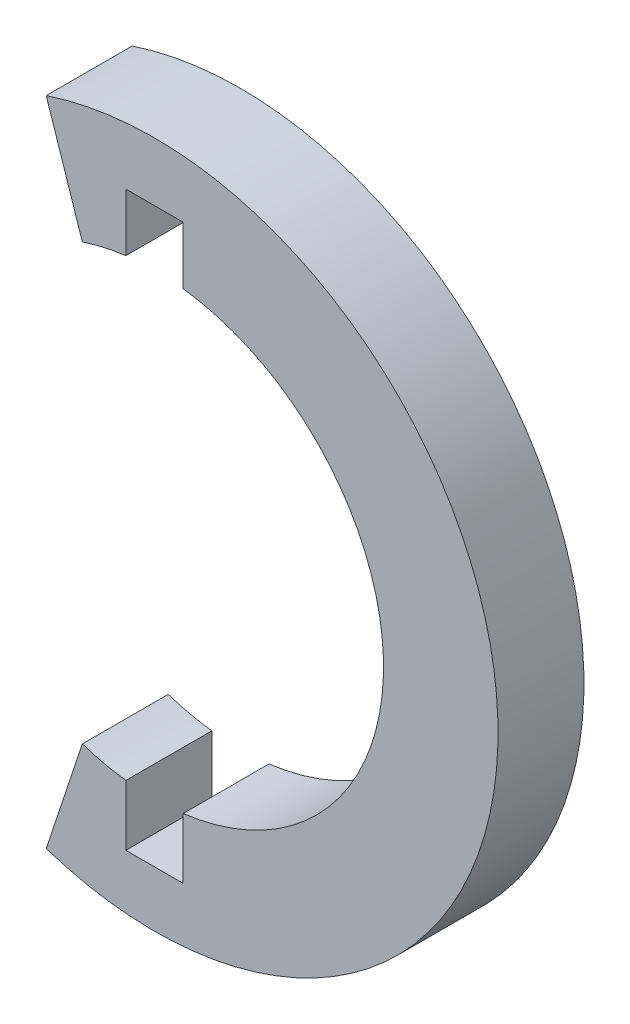
from build123d import *

# Parameters (mm, degrees)
BOSS_EXTRUDE1_DEPTH = 3


with BuildPart() as part:
    # Sketch2 → Boss-Extrude1 (new body)
    with BuildSketch(Plane.XY):
        with BuildLine():
            Line((-3.781717443, 11.388529895), (-2.521144962, 7.592353264))
            ThreePointArc((-2.521144962, 7.592353264), (-1.768998185, 7.801964203), (-1, 7.937253933))
            Line((-1, 7.937253933), (-1, 8.94427191))
            Line((-1, 8.94427191), (-1, 9.949874371))
            Line((-1, 9.949874371), (1, 9.949874371))
            Line((1, 9.949874371), (1, 8.94427191))
            Line((1, 8.94427191), (1, 7.937253933))
            ThreePointArc((1, 7.937253933), (8, 0), (1, -7.937253933))
            Line((1, -7.937253933), (1, -8.94427191))
            Line((1, -8.94427191), (1, -10.050125629))
            Line((1, -10.050125629), (-1, -10.050125629))
            Line((-1, -10.050125629), (-1, -8.94427191))
            Line((-1, -8.94427191), (-1, -7.937253933))
            ThreePointArc((-1, -7.937253933), (-1.768998185, -7.801964203), (-2.521144962, -7.592353264))
            Line((-2.521144962, -7.592353264), (-3.781717443, -11.388529895))
            ThreePointArc((-3.781717443, -11.388529895), (12, 0), (-3.781717443, 11.388529895))
        make_face()
    extrude(amount=BOSS_EXTRUDE1_DEPTH)


solid = part.part
